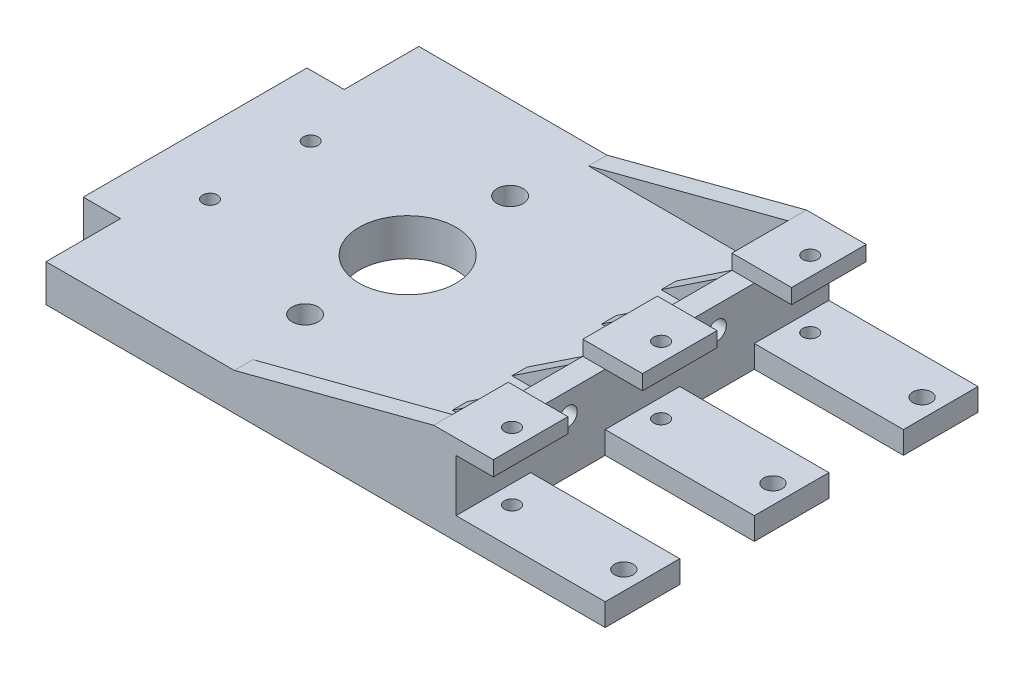
from build123d import *

# Parameters (mm, degrees)
SKETCH1_W           = 160
SKETCH1_H           = 100
BOSS_EXTRUDE1_DEPTH = 10
SKETCH2_W           = 40
SKETCH2_H           = 20
CUT_EXTRUDE1_DEPTH  = 10
SKETCH3_W           = 6
SKETCH3_H           = 20
BOSS_EXTRUDE2_DEPTH = 10
SKETCH4_W           = 40
SKETCH4_H           = 20
CUT_EXTRUDE2_DEPTH  = 4
SKETCH5_W           = 15
SKETCH5_H           = 4
BOSS_EXTRUDE3_DEPTH = 10
CUT_EXTRUDE3_DEPTH  = 100
SKETCH8_R           = 2.5
SKETCH8_R_2         = 2
CUT_EXTRUDE4_DEPTH  = 97.43650761
SKETCH10_W          = 6
SKETCH10_H          = 20
BOSS_EXTRUDE5_DEPTH = 14
SKETCH11_W          = 20
SKETCH11_H          = 4
BOSS_EXTRUDE6_DEPTH = 10
SKETCH12_R          = 2
CUT_EXTRUDE5_DEPTH  = 10
SKETCH13_R          = 2.5
CUT_EXTRUDE6_DEPTH  = 10
SKETCH14_W          = 10
SKETCH14_H          = 20
CUT_EXTRUDE7_DEPTH  = 10
SKETCH17_R          = 2
CUT_EXTRUDE8_DEPTH  = 10
SKETCH18_R          = 2.4
CUT_EXTRUDE9_DEPTH  = 4
SKETCH15_R          = 13
SKETCH15_R_2        = 3.5
CUT_EXTRUDE10_DEPTH = 10
RIB1_REACH          = 132.292
SKETCH19_WALL_W     = 317.885406234
SKETCH19_WALL_H     = 5


with BuildPart() as part:
    # Sketch1 → Boss-Extrude1 (new body)
    with BuildSketch(Plane(origin=(0, 0, 0), x_dir=(1, 0, 0), z_dir=(0, 1, 0))):
        Rectangle(SKETCH1_W, SKETCH1_H)
    extrude(amount=BOSS_EXTRUDE1_DEPTH)

    # Sketch2 → Cut-Extrude1 (cut)
    with BuildSketch(Plane(origin=(0, 10, 0), x_dir=(1, 0, 0), z_dir=(0, 1, 0))):
        with Locations((60, 20)):
            Rectangle(SKETCH2_W, SKETCH2_H)
        with Locations((60, -20)):
            Rectangle(SKETCH2_W, SKETCH2_H)
    extrude(amount=-CUT_EXTRUDE1_DEPTH, mode=Mode.SUBTRACT)

    # Sketch3 → Boss-Extrude2 (add)
    with BuildSketch(Plane(origin=(0, 10, 0), x_dir=(1, 0, 0), z_dir=(0, 1, 0))):
        with Locations((37, 20)):
            Rectangle(SKETCH3_W, SKETCH3_H)
        with Locations((37, -20)):
            Rectangle(SKETCH3_W, SKETCH3_H)
    extrude(amount=BOSS_EXTRUDE2_DEPTH)

    # Sketch4 → Cut-Extrude2 (cut)
    with BuildSketch(Plane(origin=(0, 10, 0), x_dir=(1, 0, 0), z_dir=(0, 1, 0))):
        with Locations((60, 40)):
            Rectangle(SKETCH4_W, SKETCH4_H)
        with Locations((60, 0)):
            Rectangle(SKETCH4_W, SKETCH4_H)
        with Locations((60, -40)):
            Rectangle(SKETCH4_W, SKETCH4_H)
    extrude(amount=-CUT_EXTRUDE2_DEPTH, mode=Mode.SUBTRACT)

    # Sketch5 → Boss-Extrude3 (add)
    with BuildSketch(Plane(origin=(0, 10, 0), x_dir=(1, 0, 0), z_dir=(0, 1, 0))):
        with Locations((26.5, 28)):
            Rectangle(SKETCH5_W, SKETCH5_H)
        with Locations((26.5, 12)):
            Rectangle(SKETCH5_W, SKETCH5_H)
        with Locations((26.5, -12)):
            Rectangle(SKETCH5_W, SKETCH5_H)
        with Locations((26.5, -28)):
            Rectangle(SKETCH5_W, SKETCH5_H)
    extrude(amount=BOSS_EXTRUDE3_DEPTH)

    # Sketch6 → Cut-Extrude3 (cut)
    with BuildSketch(Plane(origin=(0, 0, -30), x_dir=(-1, 0, 0), z_dir=(0, 0, -1))):
        Polygon((-19, 10), (-34, 20), (-19, 20), align=None)
    extrude(amount=-CUT_EXTRUDE3_DEPTH, mode=Mode.SUBTRACT)

    # Sketch8 → Cut-Extrude4 (cut, through all)
    with BuildSketch(Plane.XZ):
        with Locations(Location((75, 40, 0), (0, 0, 270))):
            Circle(SKETCH8_R)
        with Locations(Location((75, 0, 0), (0, 0, 270))):
            Circle(SKETCH8_R)
        with Locations(Location((75, -40, 0), (0, 0, 270))):
            Circle(SKETCH8_R)
        with Locations(Location((45, 40, 0), (0, 0, 270))):
            Circle(SKETCH8_R_2)
        with Locations(Location((45, 0, 0), (0, 0, 270))):
            Circle(SKETCH8_R_2)
        with Locations(Location((45, -40, 0), (0, 0, 270))):
            Circle(SKETCH8_R_2)
    extrude(amount=-CUT_EXTRUDE4_DEPTH, mode=Mode.SUBTRACT)

    # Sketch10 → Boss-Extrude5 (add)
    with BuildSketch(Plane(origin=(0, 10, 0), x_dir=(1, 0, 0), z_dir=(0, 1, 0))):
        with Locations((37, 40)):
            Rectangle(SKETCH10_W, SKETCH10_H)
        with Locations((37, -40)):
            Rectangle(SKETCH10_W, SKETCH10_H)
        with Locations((37, 0)):
            Rectangle(SKETCH10_W, SKETCH10_H)
    extrude(amount=BOSS_EXTRUDE5_DEPTH)

    # Sketch11 → Boss-Extrude6 (add)
    with BuildSketch(Plane(origin=(40, 0, 0), x_dir=(0, 0, -1), z_dir=(1, 0, 0))):
        with Locations((-40, 22)):
            Rectangle(SKETCH11_W, SKETCH11_H)
        with Locations((0, 22)):
            Rectangle(SKETCH11_W, SKETCH11_H)
        with Locations((40, 22)):
            Rectangle(SKETCH11_W, SKETCH11_H)
    extrude(amount=BOSS_EXTRUDE6_DEPTH)

    # Sketch12 → Cut-Extrude5 (cut)
    with BuildSketch(Plane.XZ.offset(-20)):
        with Locations(Location((45, 40, 0), (0, 0, 270))):
            Circle(SKETCH12_R)
        with Locations(Location((45, 0, 0), (0, 0, 270))):
            Circle(SKETCH12_R)
        with Locations(Location((45, -40, 0), (0, 0, 270))):
            Circle(SKETCH12_R)
    extrude(amount=-CUT_EXTRUDE5_DEPTH, mode=Mode.SUBTRACT)

    # Sketch13 → Cut-Extrude6 (cut)
    with BuildSketch(Plane.ZY.offset(-34)):
        with Locations((-20, 14)):
            Circle(SKETCH13_R)
        with Locations((20, 14)):
            Circle(SKETCH13_R)
    extrude(amount=-CUT_EXTRUDE6_DEPTH, mode=Mode.SUBTRACT)

    # Sketch14 → Cut-Extrude7 (cut)
    with BuildSketch(Plane(origin=(0, 10, 0), x_dir=(1, 0, 0), z_dir=(0, 1, 0))):
        with Locations((-75, 40)):
            Rectangle(SKETCH14_W, SKETCH14_H)
        with Locations((-75, -40)):
            Rectangle(SKETCH14_W, SKETCH14_H)
    extrude(amount=-CUT_EXTRUDE7_DEPTH, mode=Mode.SUBTRACT)

    # Sketch17 → Cut-Extrude8 (cut)
    with BuildSketch(Plane(origin=(0, 10, 0), x_dir=(1, 0, 0), z_dir=(0, 1, 0))):
        with Locations(Location((-62.5, 13.5, 0), (0, 0, 270))):
            Circle(SKETCH17_R)
        with Locations(Location((-62.5, -13.5, 0), (0, 0, 270))):
            Circle(SKETCH17_R)
    extrude(amount=-CUT_EXTRUDE8_DEPTH, mode=Mode.SUBTRACT)

    # Sketch18 → Cut-Extrude9 (cut)
    with BuildSketch(Plane.ZY.offset(70)):
        with Locations((40, 5)):
            Circle(SKETCH18_R)
        with Locations((-40, 5)):
            Circle(SKETCH18_R)
    extrude(amount=-CUT_EXTRUDE9_DEPTH, mode=Mode.SUBTRACT)

    # Sketch15 → Cut-Extrude10 (cut)
    with BuildSketch(Plane(origin=(0, 10, 0), x_dir=(1, 0, 0), z_dir=(0, 1, 0))):
        with Locations(Location((-23, 0, 0), (0, 0, 270))):
            Circle(SKETCH15_R)
        with Locations(Location((-23, 27.5, 0), (0, 0, 270))):
            Circle(SKETCH15_R_2)
        with Locations(Location((-23, -27.5, 0), (0, 0, 270))):
            Circle(SKETCH15_R_2)
    extrude(amount=-CUT_EXTRUDE10_DEPTH, mode=Mode.SUBTRACT)

    # Sketch19 wall → Rib1 (add, up to next)
    with BuildSketch(Plane(origin=(7.25, 17, -50), x_dir=(-0.967424963626, -0.253157934407, 0), z_dir=(-0.253157934407, 0.967424963626, 0)), mode=Mode.PRIVATE) as rib1_sk1:
        with Locations((0, 2.5)):
            Rectangle(SKETCH19_WALL_W, SKETCH19_WALL_H)
    rib1_tool1 = extrude(rib1_sk1.sketch, amount=-RIB1_REACH, mode=Mode.PRIVATE) - part.part
    rib1 = rib1_tool1.solids().sort_by_distance((7.25, 17, -50))[0]
    add(rib1)

    # Mirror2: Rib1 across plane
    add(rib1.mirror(Plane.XY))


solid = part.part
